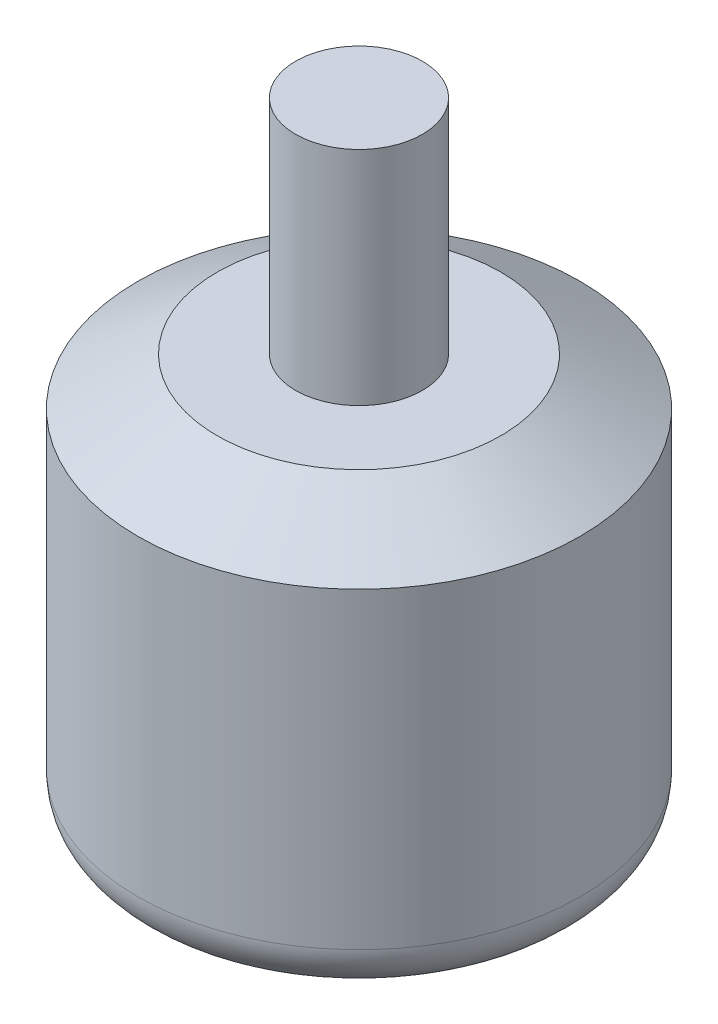
from build123d import *

# Parameters (mm, degrees)
SKETCH1_R                 = 13.95
BOSS_EXTRUDE1_DEPTH       = 25.7
CHAMFER1_SIZE             = 3
CHAMFER1_SIZE2            = 5
SKETCH2_R                 = 4
BOSS_EXTRUDE2_DEPTH       = 14
M3X0_5_TAPPED_HOLE1_D     = 2.5
M3X0_5_TAPPED_HOLE1_DEPTH = 7.5
M3X0_5_TAPPED_HOLE1_TIP   = 0.751075774
FILLET1_R                 = 3
SKETCH5_R                 = 3
BOSS_EXTRUDE3_DEPTH       = 2.5


with BuildPart() as part:
    # Sketch1 → Boss-Extrude1 (new body)
    with BuildSketch(Plane(origin=(0, 0, 0), x_dir=(1, 0, 0), z_dir=(0, 1, 0))):
        with Locations(Location((0, 0, 0), (0, 0, 90))):
            Circle(SKETCH1_R)
    extrude(amount=BOSS_EXTRUDE1_DEPTH)

    # Chamfer1
    chamfer1_edges = [part.edges().sort_by_distance(p)[0] for p in [
        (0, 25.7, 13.95),
    ]]
    chamfer1_side = [part.faces().sort_by_distance(p)[0] for p in [
        (0, 12.85, 13.95),
    ]]
    chamfer(chamfer1_edges, length=CHAMFER1_SIZE, length2=CHAMFER1_SIZE2, reference=chamfer1_side[0])

    # Sketch2 → Boss-Extrude2 (add)
    with BuildSketch(Plane(origin=(0, 25.7, 0), x_dir=(1, 0, 0), z_dir=(0, 1, 0))):
        with Locations(Location((0, 0, 0), (0, 0, 270))):
            Circle(SKETCH2_R)
    extrude(amount=BOSS_EXTRUDE2_DEPTH)

    # M3x0.5 Tapped Hole1
    with Locations(Plane(origin=(0, 0, 0), x_dir=(-1, 0, 0), z_dir=(0, -1, 0))):
        with Locations((0, 8), (0, -8), (-9.5, 0), (9.5, 0)):
            Hole(M3X0_5_TAPPED_HOLE1_D / 2, depth=M3X0_5_TAPPED_HOLE1_DEPTH)
            with Locations((0, 0, -(M3X0_5_TAPPED_HOLE1_DEPTH + M3X0_5_TAPPED_HOLE1_TIP / 2))):  # 118° drill point
                Cone(0, M3X0_5_TAPPED_HOLE1_D / 2, M3X0_5_TAPPED_HOLE1_TIP, mode=Mode.SUBTRACT)

    # Fillet1
    fillet1_edges = [part.edges().sort_by_distance(p)[0] for p in [
        (0, 0, 13.95),
    ]]
    fillet(fillet1_edges, radius=FILLET1_R)

    # Sketch5 → Boss-Extrude3 (add)
    with BuildSketch(Plane.XZ):
        with Locations(Location((0, 0, 0), (0, 0, 90))):
            Circle(SKETCH5_R)
    extrude(amount=BOSS_EXTRUDE3_DEPTH)


solid = part.part
